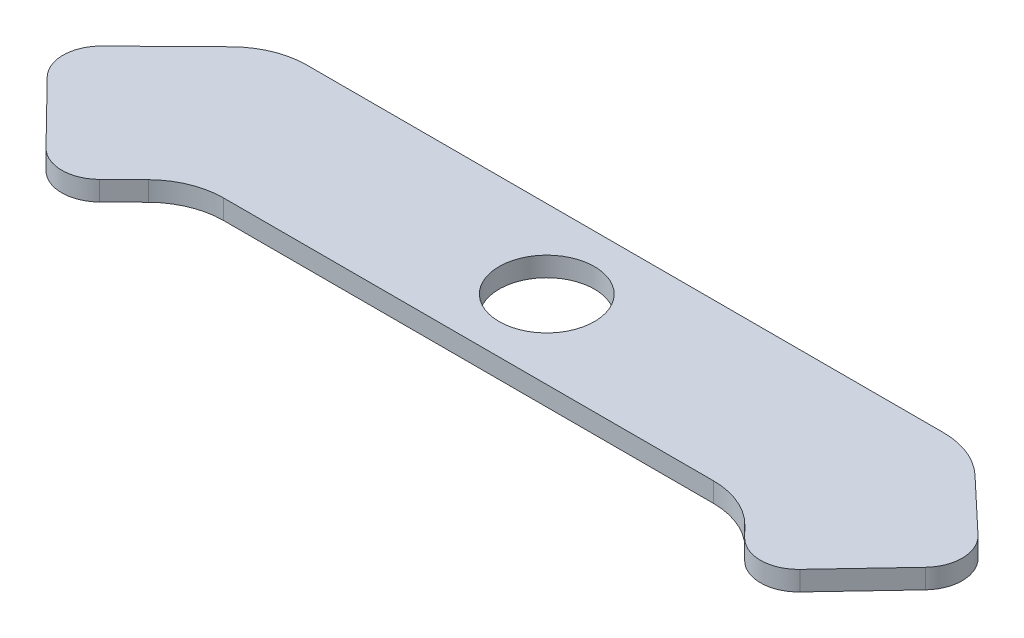
from build123d import *

# Parameters (mm, degrees)
SKETCH2_R           = 4.868124445
BOSS_EXTRUDE1_DEPTH = 2


with BuildPart() as part:
    # Sketch2 → Boss-Extrude1 (new body)
    with BuildSketch(Plane(origin=(0, 0, 0), x_dir=(1, 0, 0), z_dir=(0, 1, 0))):
        with BuildLine():
            ThreePointArc((37.278070291, -11.408685578), (34.482702596, -12.629587927), (31.664894392, -11.461409849))
            Line((31.664894392, -11.461409849), (30.562457969, -10.336699734))
            ThreePointArc((30.562457969, -10.336699734), (28.016666385, -8.607896753), (25, -8))
            Line((25, -8), (-25, -8))
            ThreePointArc((-25, -8), (-27.944700918, -8.578087681), (-30.452299379, -10.226541143))
            Line((-30.452299379, -10.226541143), (-32.975396929, -12.699671418))
            ThreePointArc((-32.975396929, -12.699671418), (-35.740493562, -13.812747241), (-38.482775603, -12.644592123))
            Line((-38.482775603, -12.644592123), (-44.703876064, -6.297800167))
            ThreePointArc((-44.703876064, -6.297800167), (-45.816951887, -3.532703535), (-44.648796769, -0.790421493))
            Line((-44.648796769, -0.790421493), (-37.952299379, 5.773458857))
            ThreePointArc((-37.952299379, 5.773458857), (-35.444700918, 7.421912319), (-32.5, 8))
            Line((-32.5, 8), (32.5, 8))
            ThreePointArc((32.5, 8), (35.376842294, 7.449252444), (37.846850837, 5.874894716))
            Line((37.846850837, 5.874894716), (43.341622103, 0.687699611))
            ThreePointArc((43.341622103, 0.687699611), (44.561082794, -2.032155678), (43.500143599, -4.817672722))
            Line((43.500143599, -4.817672722), (37.278070291, -11.408685578))
        make_face()
        with Locations(Location((0, 0, 0), (0, 0, 270))):
            Circle(SKETCH2_R, mode=Mode.SUBTRACT)
    extrude(amount=BOSS_EXTRUDE1_DEPTH)


solid = part.part
